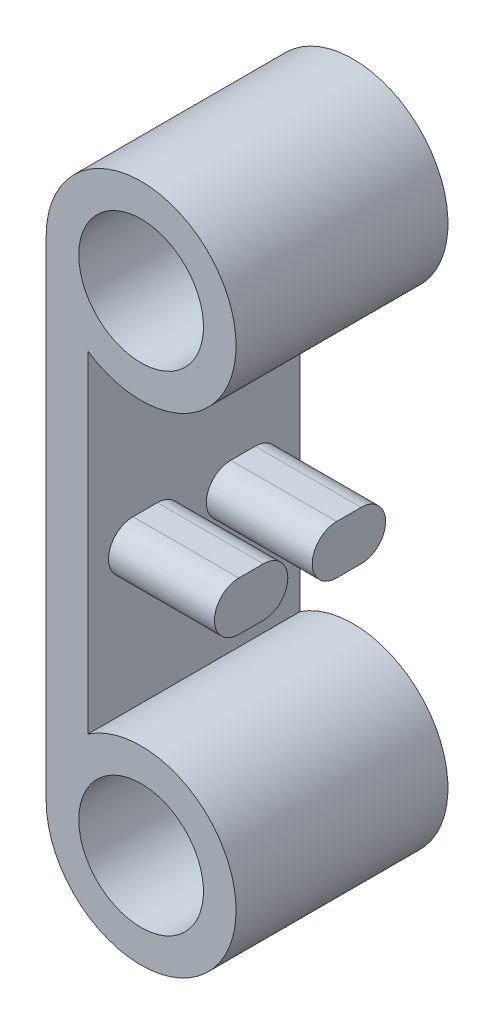
from build123d import *

# Parameters (mm, degrees)
ESBO_O1_R                = 7.65
RESSALTO_EXTRUS_O1_DEPTH = 26
RESSALTO_EXTRUS_O2_DEPTH = 13
ESBO_O7_W                = 15
ESBO_O7_H                = 25
RESSALTO_EXTRUS_O3_DEPTH = 3
ESBO_O8_R                = 1.5
CORTE_EXTRUS_O1_DEPTH    = 15


with BuildPart() as part:
    # Esboço1 → Ressalto-extrusão1 (new body)
    with BuildSketch(Plane.XY):
        with BuildLine():
            Line((-11.65, 30), (-11.65, 28))
            Line((-11.65, 28), (-11.65, -30))
            ThreePointArc((-11.65, -30), (10.282205503, -35.477111465), (-6.5, -20.331882293))
            Line((-6.5, -20.331882293), (-6.5, 20.331882293))
            ThreePointArc((-6.5, 20.331882293), (10.282205503, 35.477111465), (-11.65, 30))
        make_face()
        with Locations((0, 30)):
            Circle(ESBO_O1_R, mode=Mode.SUBTRACT)
        with Locations((0, -30)):
            Circle(ESBO_O1_R, mode=Mode.SUBTRACT)
    extrude(amount=RESSALTO_EXTRUS_O1_DEPTH)

    # Esboço6 → Ressalto-extrusão2 (add)
    with BuildSketch(Plane(origin=(-6.5, 0, 0), x_dir=(0, 0, -1), z_dir=(1, 0, 0))):
        with BuildLine():
            Line((-17.5, -6), (-20.5, -6))
            ThreePointArc((-20.5, -6), (-23.5, -3), (-20.5, 0))
            Line((-20.5, 0), (-17.5, 0))
            ThreePointArc((-17.5, 0), (-14.5, -3), (-17.5, -6))
        make_face()
        with BuildLine():
            Line((-8.5, -6), (-5.5, -6))
            ThreePointArc((-5.5, -6), (-2.5, -3), (-5.5, 0))
            Line((-5.5, 0), (-8.5, 0))
            ThreePointArc((-8.5, 0), (-11.5, -3), (-8.5, -6))
        make_face()
    extrude(amount=RESSALTO_EXTRUS_O2_DEPTH)

    # Esboço7 → Ressalto-extrusão3 (add)
    with BuildSketch(Plane.ZY.offset(11.65)):
        with Locations((13, -10)):
            Rectangle(ESBO_O7_W, ESBO_O7_H)
    extrude(amount=RESSALTO_EXTRUS_O3_DEPTH)

    # Esboço8 → Corte-extrusão1 (cut)
    with BuildSketch(Plane.ZY.offset(14.65)):
        with Locations((13, -10)):
            Circle(ESBO_O8_R)
    extrude(amount=-CORTE_EXTRUS_O1_DEPTH, mode=Mode.SUBTRACT)


solid = part.part
